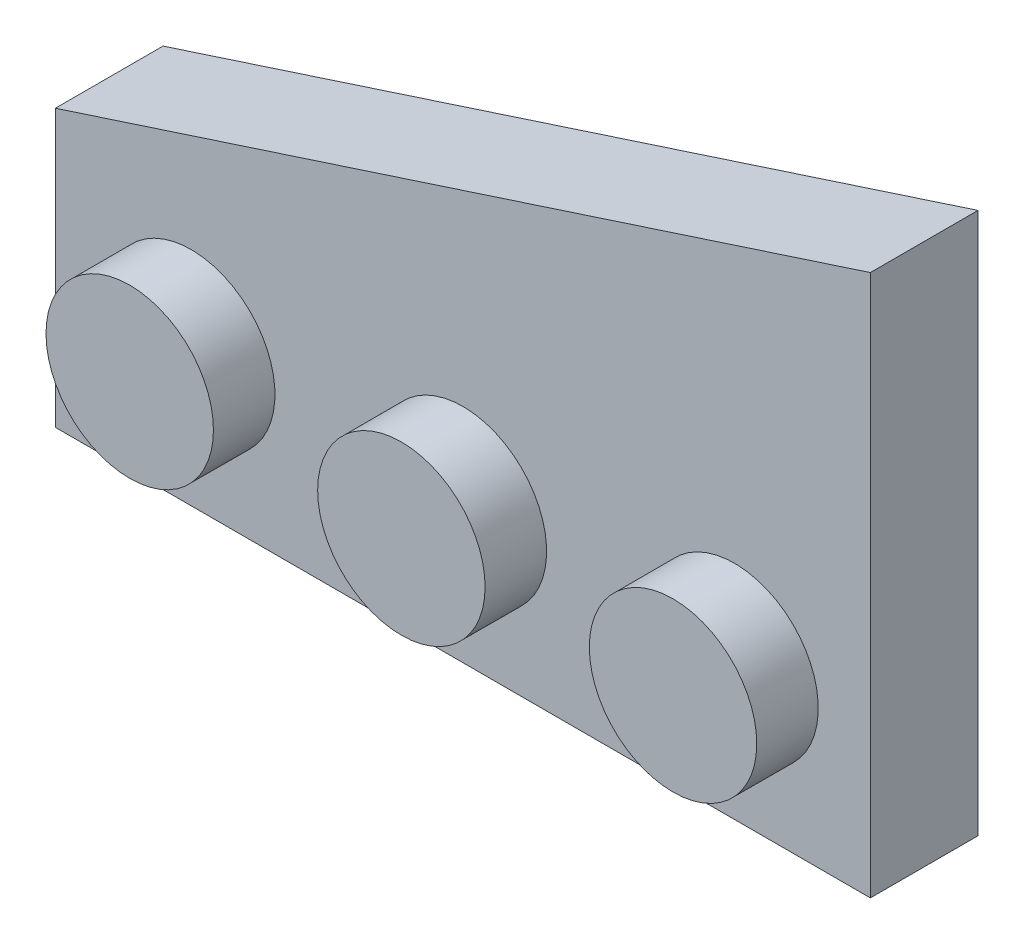
from build123d import *

# Parameters (mm, degrees)
BOSS_EXTRUDE1_DEPTH = 3.15
SKETCH2_R           = 2.45
BOSS_EXTRUDE2_DEPTH = 1.8
SHELL1_T            = -1.5


with BuildPart() as part:
    # Sketch1 → Boss-Extrude1 (new body)
    with BuildSketch(Plane.XY):
        Polygon((0, 15.85), (0, 0), (-23.85, 0), (-23.85, 8.09), align=None)
    extrude(amount=-BOSS_EXTRUDE1_DEPTH)

    # Sketch2 → Boss-Extrude2 (add)
    with BuildSketch(Plane.XY):
        with Locations(Location((-3.975, 4.045, 0), (0, 0, 180))):
            Circle(SKETCH2_R)
        with Locations(Location((-11.925, 4.045, 0), (0, 0, 180))):
            Circle(SKETCH2_R)
        with Locations(Location((-19.875, 4.045, 0), (0, 0, 180))):
            Circle(SKETCH2_R)
    extrude(amount=BOSS_EXTRUDE2_DEPTH)

    # Shell1
    shell1_openings = [part.faces().sort_by_distance(p)[0] for p in [
        (-10.636528822, 6.194612921, -3.15),
    ]]
    offset(amount=SHELL1_T, openings=shell1_openings, kind=Kind.INTERSECTION)


solid = part.part
